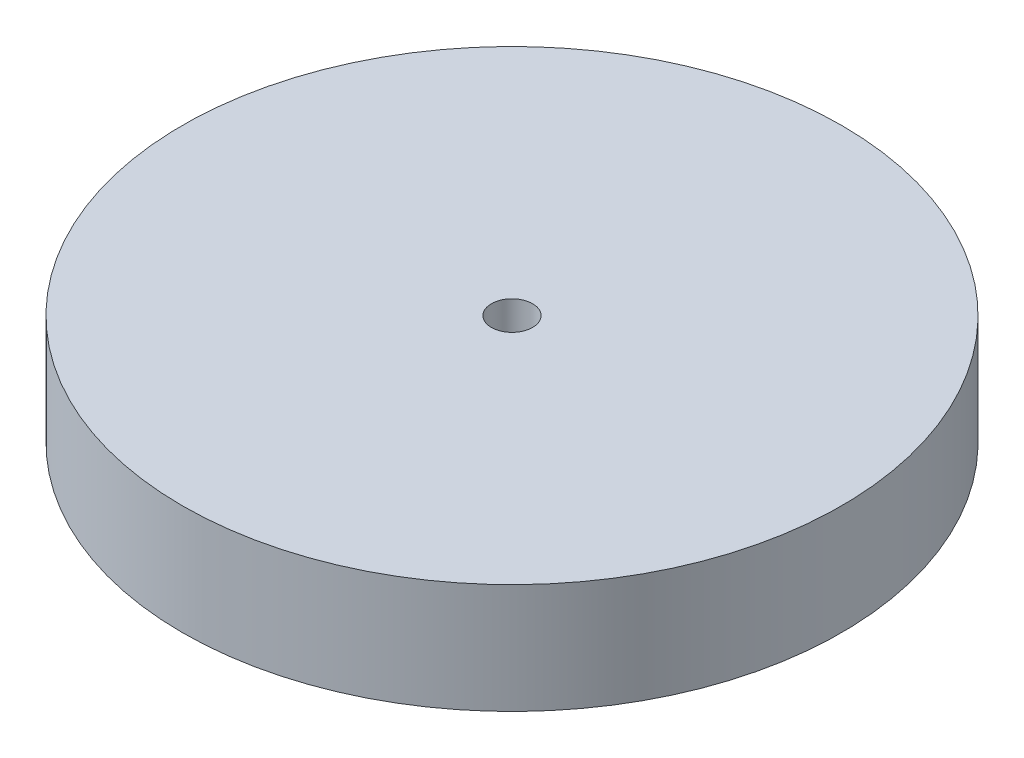
from build123d import *

# Parameters (mm, degrees)
SKETCH1_W          = 76.2
SKETCH1_H          = 25.4
SKETCH2_R          = 4.7625
CUT_EXTRUDE1_DEPTH = 111.716033166


with BuildPart() as part:
    # Sketch1 → Revolve1 (revolve)
    with BuildSketch(Plane.XY, mode=Mode.PRIVATE) as revolve1_sk:
        with Locations((38.1, 0)):
            Rectangle(SKETCH1_W, SKETCH1_H)
    revolve(revolve1_sk.sketch.rotate(Axis((0, 5354.328, 0), (0, -1, 0)), 90), axis=Axis((0, 5354.328, 0), (0, -1, 0)))

    # Sketch2 → Cut-Extrude1 (cut, through all)
    with BuildSketch(Plane.XZ.offset(12.7)):
        with Locations(Location((0, 0, 0), (0, 0, 270))):
            Circle(SKETCH2_R)
    extrude(amount=-CUT_EXTRUDE1_DEPTH, mode=Mode.SUBTRACT)


solid = part.part
